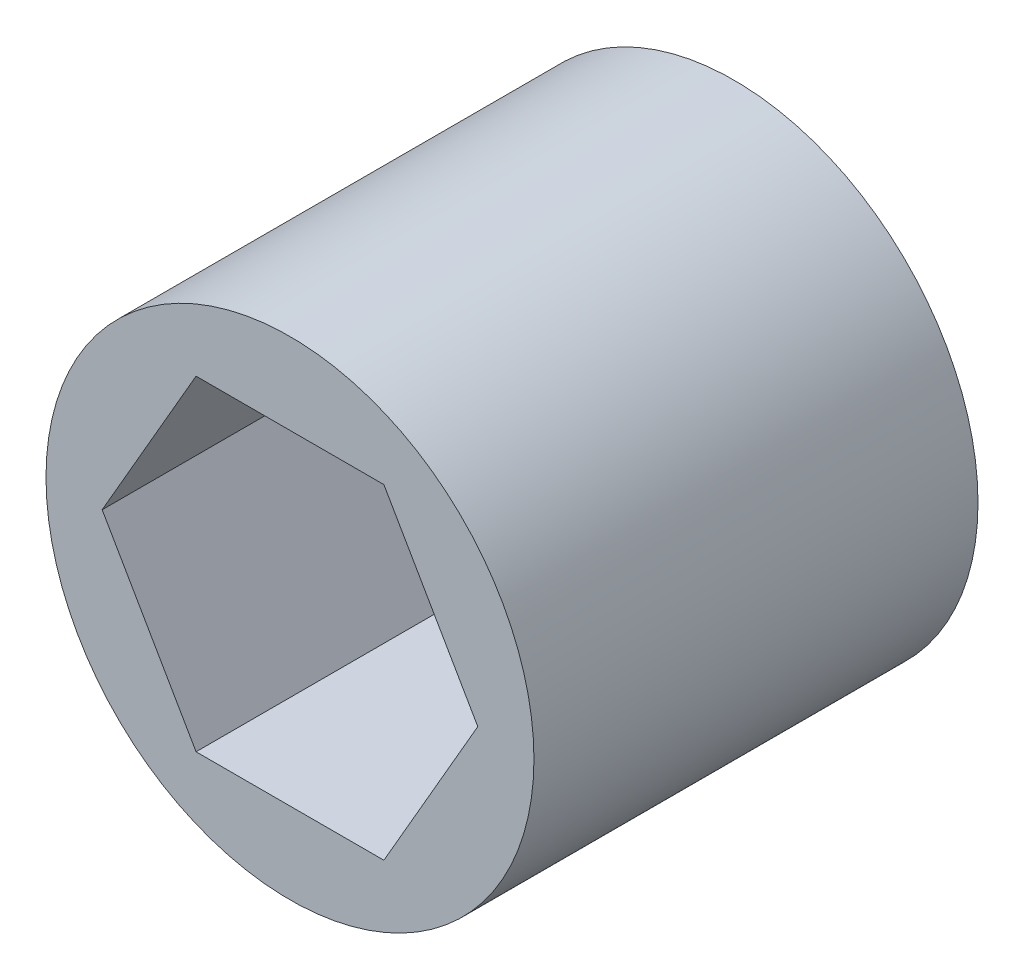
from build123d import *

# Parameters (mm, degrees)
SKETCH1_R           = 9.525
BOSS_EXTRUDE1_DEPTH = 17.3355


with BuildPart() as part:
    # Sketch1 → Boss-Extrude1 (new body)
    with BuildSketch(Plane.XY):
        Circle(SKETCH1_R)
        Polygon((7.332348419, 0), (3.666174209, 6.35), (-3.666174209, 6.35), (-7.332348419, 0), (-3.666174209, -6.35), (3.666174209, -6.35), align=None, mode=Mode.SUBTRACT)
    extrude(amount=BOSS_EXTRUDE1_DEPTH)


solid = part.part
